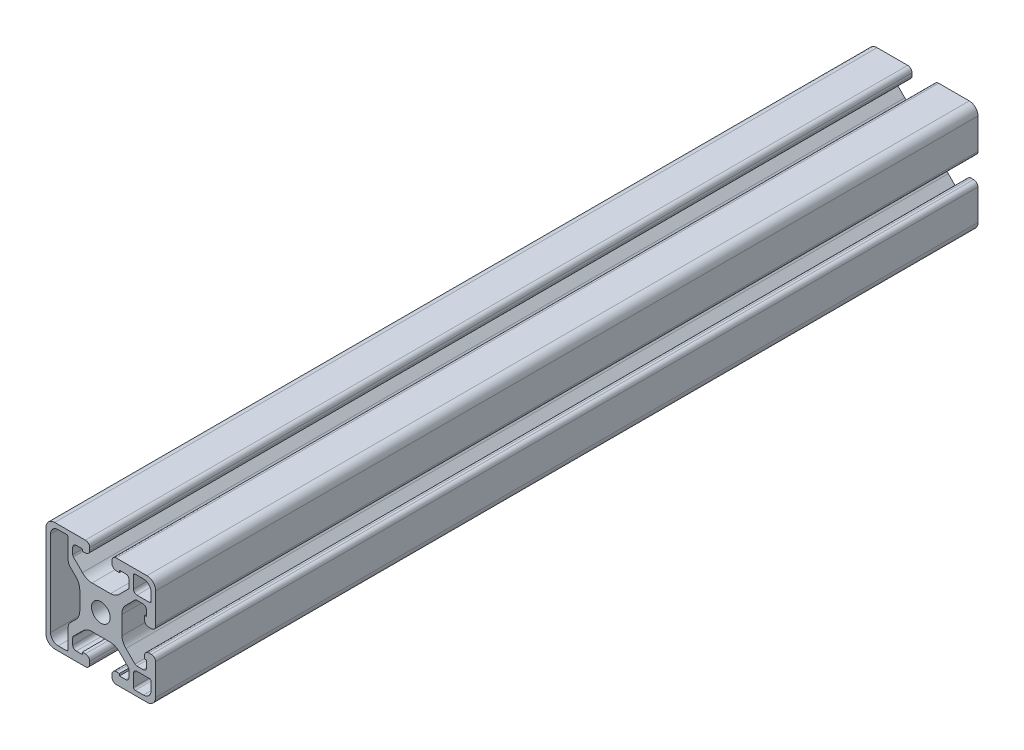
from build123d import *

# Parameters (mm, degrees)
SKETCH1_R      = 3.4
EXTRUDE1_DEPTH = 300


with BuildPart() as part:
    # Sketch1 → Extrude1 (new body)
    with BuildSketch(Plane.XY):
        with BuildLine():
            Line((3.546734719, 7.685), (-3.215668941, 7.685))
            ThreePointArc((-3.215668941, 7.685), (-5.12166397, 8.084192802), (-6.707283616, 9.214671586))
            Line((-6.707283616, 9.214671586), (-9.994083925, 12.501471895))
            ThreePointArc((-9.994083925, 12.501471895), (-10.186794901, 12.789884252), (-10.254465997, 13.130089823))
            Line((-10.254465997, 13.130089823), (-10.254465997, 15.428464473))
            ThreePointArc((-10.254465997, 15.428464473), (-9.882491609, 16.326490085), (-8.984465997, 16.698464473))
            Line((-8.984465997, 16.698464473), (-6.775217878, 16.698464473))
            Line((-6.775217878, 16.698464473), (-6.775217878, 15.936))
            Line((-6.775217878, 15.936), (-5.6348, 15.936))
            ThreePointArc((-5.6348, 15.936), (-4.521248241, 16.397248241), (-4.06, 17.5108))
            Line((-4.06, 17.5108), (-4.06, 18.4252))
            ThreePointArc((-4.06, 18.4252), (-4.521248241, 19.538751759), (-5.6348, 20))
            Line((-5.6348, 20), (-13.0175, 20))
            Line((-13.0175, 20), (-16.825, 20))
            ThreePointArc((-16.825, 20), (-19.07006403, 19.07006403), (-20, 16.825))
            Line((-20, 16.825), (-20, -16.825))
            ThreePointArc((-20, -16.825), (-19.07006403, -19.07006403), (-16.825, -20))
            Line((-16.825, -20), (-13.0175, -20))
            Line((-13.0175, -20), (-5.6348, -20))
            ThreePointArc((-5.6348, -20), (-4.521248241, -19.538751759), (-4.06, -18.4252))
            Line((-4.06, -18.4252), (-4.06, -17.5108))
            ThreePointArc((-4.06, -17.5108), (-4.521248241, -16.397248241), (-5.6348, -15.936))
            Line((-5.6348, -15.936), (-6.775217878, -15.936))
            Line((-6.775217878, -15.936), (-6.775217878, -16.698464473))
            Line((-6.775217878, -16.698464473), (-8.984465997, -16.698464473))
            ThreePointArc((-8.984465997, -16.698464473), (-9.882491609, -16.326490085), (-10.254465997, -15.428464473))
            Line((-10.254465997, -15.428464473), (-10.254465997, -13.130554296))
            ThreePointArc((-10.254465997, -13.130554296), (-10.186794901, -12.790348725), (-9.994083925, -12.501936368))
            Line((-9.994083925, -12.501936368), (-6.707283616, -9.215136058))
            ThreePointArc((-6.707283616, -9.215136058), (-5.121525017, -8.084319577), (-3.21524064, -7.685))
            Line((-3.21524064, -7.685), (3.384844934, -7.685))
            ThreePointArc((3.384844934, -7.685), (5.234788394, -8.060064667), (6.792572846, -9.126025224))
            Line((6.792572846, -9.126025224), (9.994035567, -12.327487945))
            ThreePointArc((9.994035567, -12.327487945), (10.186746543, -12.615900302), (10.254417639, -12.956105874))
            Line((10.254417639, -12.956105874), (10.254417639, -15.439547173))
            ThreePointArc((10.254417639, -15.439547173), (9.878564697, -16.3303999), (8.984465997, -16.698464473))
            Line((8.984465997, -16.698464473), (6.775217878, -16.698464473))
            Line((6.775217878, -16.698464473), (6.775217878, -15.936))
            Line((6.775217878, -15.936), (5.6348, -15.936))
            ThreePointArc((5.6348, -15.936), (4.521248241, -16.397248241), (4.06, -17.5108))
            Line((4.06, -17.5108), (4.06, -18.4252))
            ThreePointArc((4.06, -18.4252), (4.521248241, -19.538751759), (5.6348, -20))
            Line((5.6348, -20), (13.34169248, -20))
            Line((13.34169248, -20), (17.15169248, -20))
            ThreePointArc((17.15169248, -20), (19.188402964, -18.962027535), (20, -16.825))
            Line((20, -16.825), (20, -13.015))
            Line((20, -13.015), (20, -5.5728))
            ThreePointArc((20, -5.5728), (19.517832289, -4.499539536), (18.426420946, -4.06))
            Line((18.426420946, -4.06), (17.5148, -4.06))
            ThreePointArc((17.5148, -4.06), (16.401248241, -4.521248241), (15.94, -5.6348))
            Line((15.94, -5.6348), (15.94, -6.775217878))
            Line((15.94, -6.775217878), (16.702464473, -6.775217878))
            Line((16.702464473, -6.775217878), (16.702464473, -8.984465997))
            ThreePointArc((16.702464473, -8.984465997), (16.363032482, -9.986041481), (15.382992443, -10.383394031))
            Line((15.382992443, -10.383394031), (13.085082266, -10.383394031))
            ThreePointArc((13.085082266, -10.383394031), (12.744876695, -10.315722936), (12.456464338, -10.12301196))
            Line((12.456464338, -10.12301196), (9.169664028, -6.83621165))
            ThreePointArc((9.169664028, -6.83621165), (8.107276575, -5.34917353), (7.685, -3.571075679))
            Line((7.685, -3.571075679), (7.685, 3.191327981))
            ThreePointArc((7.685, 3.191327981), (7.983205038, 5.049694415), (8.979790179, 6.646337802))
            Line((8.979790179, 6.646337802), (12.266590489, 9.933138111))
            ThreePointArc((12.266590489, 9.933138111), (12.592412986, 10.262627227), (13.039781689, 10.383394031))
            Line((13.039781689, 10.383394031), (15.37809843, 10.383394031))
            ThreePointArc((15.37809843, 10.383394031), (16.251511682, 10.035375209), (16.646241073, 9.182054333))
            Line((16.646241073, 9.182054333), (16.646241073, 6.972806215))
            Line((16.646241073, 6.972806215), (15.94, 6.972806215))
            Line((15.94, 6.972806215), (15.94, 5.832388337))
            ThreePointArc((15.94, 5.832388337), (16.321009151, 4.593446811), (17.502355238, 4.06))
            Line((17.502355238, 4.06), (18.4252, 4.06))
            ThreePointArc((18.4252, 4.06), (19.538751759, 4.521248241), (20, 5.6348))
            Line((20, 5.6348), (20, 13.01422635))
            Line((20, 13.01422635), (20, 16.82422635))
            ThreePointArc((20, 16.82422635), (19.070337634, 19.069790487), (16.825000094, 20))
            Line((16.825000094, 20), (13.290515583, 20))
            Line((13.290515583, 20), (5.6348, 20))
            ThreePointArc((5.6348, 20), (4.521248241, 19.538751759), (4.06, 18.4252))
            Line((4.06, 18.4252), (4.06, 17.5108))
            ThreePointArc((4.06, 17.5108), (4.521248241, 16.397248241), (5.6348, 15.936))
            Line((5.6348, 15.936), (6.775217878, 15.936))
            Line((6.775217878, 15.936), (6.775217878, 16.698464473))
            Line((6.775217878, 16.698464473), (8.984465997, 16.698464473))
            ThreePointArc((8.984465997, 16.698464473), (9.921702832, 16.349296475), (10.315534003, 15.429933551))
            Line((10.315534003, 15.429933551), (10.315534003, 13.130863473))
            ThreePointArc((10.315534003, 13.130863473), (10.284388293, 12.763467996), (10.106856362, 12.44030874))
            Line((10.106856362, 12.44030874), (6.825600792, 9.15905317))
            ThreePointArc((6.825600792, 9.15905317), (5.331011713, 8.099837434), (3.546734719, 7.685))
        make_face()
        Circle(SKETCH1_R, mode=Mode.SUBTRACT)
        with BuildLine():
            Line((11.904417639, 17.715), (11.904417639, 13.303394031))
            ThreePointArc((11.904417639, 13.303394031), (12.276392027, 12.405368419), (13.174417639, 12.033394031))
            Line((13.174417639, 12.033394031), (17.715, 12.033394031))
            ThreePointArc((17.715, 12.033394031), (18.164012806, 12.219381225), (18.35, 12.668394031))
            Line((18.35, 12.668394031), (18.35, 15.556))
            ThreePointArc((18.35, 15.556), (17.531656347, 17.531656347), (15.556, 18.35))
            Line((15.556, 18.35), (12.539417639, 18.35))
            ThreePointArc((12.539417639, 18.35), (12.090404833, 18.164012806), (11.904417639, 17.715))
        make_face(mode=Mode.SUBTRACT)
        with BuildLine():
            Line((-12.566039342, -18.35), (-15.556000403, -18.35))
            ThreePointArc((-15.556000403, -18.35), (-17.531126348, -17.532186606), (-18.35, -15.5575))
            Line((-18.35, -15.5575), (-18.35, 15.5575))
            ThreePointArc((-18.35, 15.5575), (-17.531126348, 17.532186606), (-15.556000403, 18.35))
            Line((-15.556000403, 18.35), (-12.566039304, 18.35))
            ThreePointArc((-12.566039304, 18.35), (-12.11943409, 18.166407557), (-11.931075623, 17.721791441))
            Line((-11.931075623, 17.721791441), (-11.931075623, 10.955502483))
            ThreePointArc((-11.931075623, 10.955502483), (-11.717102891, 9.676453683), (-11.00956403, 8.589651528))
            Line((-11.00956403, 8.589651528), (-9.076184211, 6.656271709))
            ThreePointArc((-9.076184211, 6.656271709), (-8.046556996, 5.115325687), (-7.685, 3.29765592))
            Line((-7.685, 3.29765592), (-7.685, -3.46474774))
            ThreePointArc((-7.685, -3.46474774), (-8.065971567, -5.27844769), (-9.112016323, -6.808296445))
            Line((-9.112016323, -6.808296445), (-11.065958077, -8.720893286))
            ThreePointArc((-11.065958077, -8.720893286), (-11.717420577, -9.753448518), (-11.931075623, -10.95549894))
            Line((-11.931075623, -10.95549894), (-11.931075623, -17.721787898))
            ThreePointArc((-11.931075623, -17.721787898), (-12.119432868, -18.166406311), (-12.566039342, -18.35))
        make_face(mode=Mode.SUBTRACT)
        with BuildLine():
            Line((15.556, -18.35), (12.539417639, -18.35))
            ThreePointArc((12.539417639, -18.35), (12.090404833, -18.164012806), (11.904417639, -17.715))
            Line((11.904417639, -17.715), (11.904417639, -13.303394031))
            ThreePointArc((11.904417639, -13.303394031), (12.276392027, -12.405368419), (13.174417639, -12.033394031))
            Line((13.174417639, -12.033394031), (17.715, -12.033394031))
            ThreePointArc((17.715, -12.033394031), (18.164012806, -12.219381225), (18.35, -12.668394031))
            Line((18.35, -12.668394031), (18.35, -15.556))
            ThreePointArc((18.35, -15.556), (17.531656347, -17.531656347), (15.556, -18.35))
        make_face(mode=Mode.SUBTRACT)
    extrude(amount=-EXTRUDE1_DEPTH)


solid = part.part
